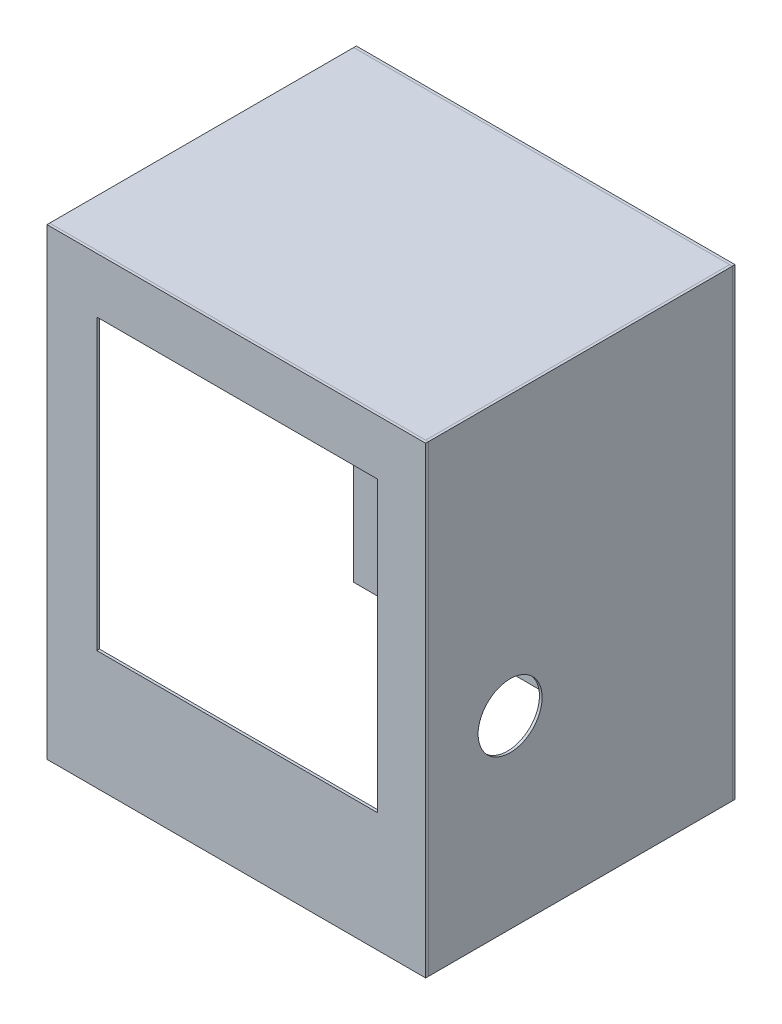
from build123d import *

# Parameters (mm, degrees)
SKETCH1_W           = 676.275
SKETCH1_H           = 827.0875
BOSS_EXTRUDE1_DEPTH = 4.7625
SKETCH2_W           = 4.7625
SKETCH2_H           = 827.0875
BOSS_EXTRUDE2_DEPTH = 542.925
SKETCH7_W           = 676.275
SKETCH7_H           = 827.0875
BOSS_EXTRUDE4_DEPTH = 4.7625
SKETCH8_W           = 671.5125
SKETCH8_H           = 542.925
BOSS_EXTRUDE6_DEPTH = 4.7625
SKETCH9_W           = 501.65
SKETCH9_H           = 515.9375
CUT_EXTRUDE1_DEPTH  = 4.7625
SKETCH10_R          = 57.15
CUT_EXTRUDE2_DEPTH  = 1201.576197472


with BuildPart() as part:
    # Sketch1 → Boss-Extrude1 (new body)
    with BuildSketch(Plane.XY):
        with Locations((338.1375, 413.54375)):
            Rectangle(SKETCH1_W, SKETCH1_H)
    extrude(amount=BOSS_EXTRUDE1_DEPTH)

    # Sketch9 → Cut-Extrude1 (cut)
    with BuildSketch(Plane.XY.offset(4.7625)):
        with Locations((339.725, 470.69375)):
            Rectangle(SKETCH9_W, SKETCH9_H)
    extrude(amount=-CUT_EXTRUDE1_DEPTH, mode=Mode.SUBTRACT)


with BuildPart() as body_2:
    # Sketch2 → Boss-Extrude2 (new body)
    with BuildSketch(Plane(origin=(0, 0, 0), x_dir=(-1, 0, 0), z_dir=(0, 0, -1))):
        with Locations((-673.89375, 413.54375)):
            Rectangle(SKETCH2_W, SKETCH2_H)
    extrude(amount=BOSS_EXTRUDE2_DEPTH)

    # Sketch10 → Cut-Extrude2 (cut, through all)
    with BuildSketch(Plane(origin=(676.275, 0, 0), x_dir=(0, 0, -1), z_dir=(1, 0, 0))):
        with Locations(Location((146.05, 330.2, 0), (0, 0, 90))):
            Circle(SKETCH10_R)
    extrude(amount=-CUT_EXTRUDE2_DEPTH, mode=Mode.SUBTRACT)


with BuildPart() as body_3:
    # Sketch7 → Boss-Extrude4 (new body)
    with BuildSketch(Plane(origin=(0, 0, -542.925), x_dir=(-1, 0, 0), z_dir=(0, 0, -1))):
        with Locations((-338.1375, 413.54375)):
            Rectangle(SKETCH7_W, SKETCH7_H)
    extrude(amount=BOSS_EXTRUDE4_DEPTH)


with BuildPart() as body_4:
    # Sketch8 → Boss-Extrude6 (new body)
    with BuildSketch(Plane(origin=(0, 827.0875, 0), x_dir=(1, 0, 0), z_dir=(0, 1, 0))):
        with Locations((335.75625, 271.4625)):
            Rectangle(SKETCH8_W, SKETCH8_H)
    extrude(amount=-BOSS_EXTRUDE6_DEPTH)


solid = Compound([part.part, body_2.part, body_3.part, body_4.part])
